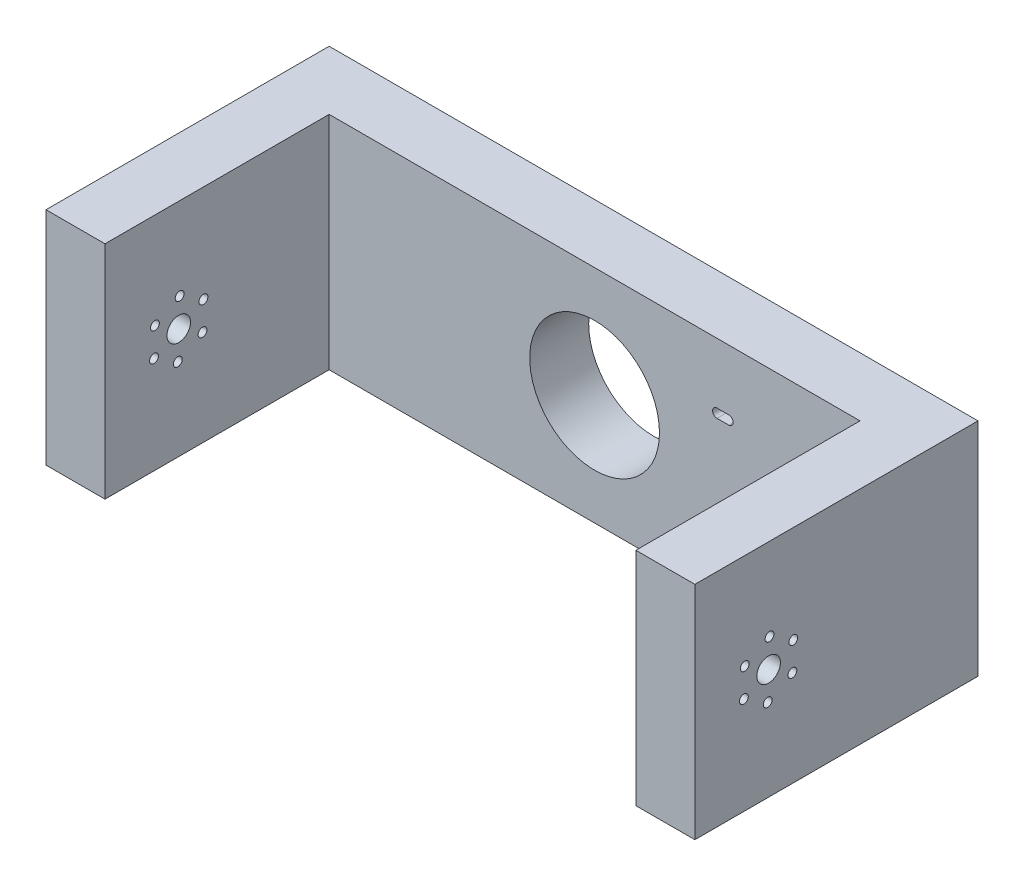
from build123d import *

# Parameters (mm, degrees)
ESQUISSE1_W             = 220
ESQUISSE1_H             = 75
BOSS_EXTRU_1_DEPTH      = 20
ESQUISSE2_W             = 20
ESQUISSE2_H             = 75
BOSS_EXTRU_2_DEPTH      = 76
ESQUISSE3_R             = 4
ENL_V_MAT_EXTRU_1_DEPTH = 252.4776332
ESQUISSE4_R             = 22
ENL_V_MAT_EXTRU_2_DEPTH = 76
ESQUISSE5_R             = 1.5
ENL_V_MAT_EXTRU_3_DEPTH = 252.4776332
ENL_V_MAT_EXTRU_5_DEPTH = 245.542429856


with BuildPart() as part:
    # Esquisse1 → Boss.-Extru.1 (new body)
    with BuildSketch(Plane.XY):
        with Locations((110, 37.5)):
            Rectangle(ESQUISSE1_W, ESQUISSE1_H)
    extrude(amount=BOSS_EXTRU_1_DEPTH)

    # Esquisse2 → Boss.-Extru.2 (add)
    with BuildSketch(Plane.XY.offset(20)):
        with Locations((210, 37.5)):
            Rectangle(ESQUISSE2_W, ESQUISSE2_H)
        with Locations((10, 37.5)):
            Rectangle(ESQUISSE2_W, ESQUISSE2_H)
    extrude(amount=BOSS_EXTRU_2_DEPTH)

    # Esquisse3 → Enlèv. mat.-Extru.1 (cut, through all)
    with BuildSketch(Plane(origin=(220, 0, 0), x_dir=(0, 0, -1), z_dir=(1, 0, 0))):
        with Locations((-71, 37.5)):
            Circle(ESQUISSE3_R)
    extrude(amount=-ENL_V_MAT_EXTRU_1_DEPTH, mode=Mode.SUBTRACT)

    # Esquisse4 → Enlèv. mat.-Extru.2 (cut)
    with BuildSketch(Plane.XY.offset(20)):
        with Locations((110, 37.5)):
            Circle(ESQUISSE4_R)
    extrude(amount=-ENL_V_MAT_EXTRU_2_DEPTH, mode=Mode.SUBTRACT)

    # Esquisse5 → Enlèv. mat.-Extru.3 (cut, through all)
    with BuildSketch(Plane(origin=(220, 0, 0), x_dir=(0, 0, -1), z_dir=(1, 0, 0))):
        with Locations((-70.685514893, 47)):
            Circle(ESQUISSE5_R)
        with Locations((-62.61551611, 41.977647908)):
            Circle(ESQUISSE5_R)
        with Locations((-62.930001218, 32.477647908)):
            Circle(ESQUISSE5_R)
        with Locations((-71.314485107, 28)):
            Circle(ESQUISSE5_R)
        with Locations((-79.38448389, 33.022352092)):
            Circle(ESQUISSE5_R)
        with Locations((-79.069998782, 42.522352092)):
            Circle(ESQUISSE5_R)
    extrude(amount=-ENL_V_MAT_EXTRU_3_DEPTH, mode=Mode.SUBTRACT)

    # Esquisse6 → Enlèv. mat.-Extru.5 (cut, through all)
    with BuildSketch(Plane.XY.offset(20)):
        with BuildLine():
            Line((182.5, 54.5), (186.5, 54.5))
            ThreePointArc((186.5, 54.5), (188, 53), (186.5, 51.5))
            Line((186.5, 51.5), (182.5, 51.5))
            ThreePointArc((182.5, 51.5), (181, 53), (182.5, 54.5))
        make_face()
        with BuildLine():
            Line((151.5, 51.5), (155.5, 51.5))
            ThreePointArc((155.5, 51.5), (157, 53), (155.5, 54.5))
            Line((155.5, 54.5), (151.5, 54.5))
            ThreePointArc((151.5, 54.5), (150, 53), (151.5, 51.5))
        make_face()
        with BuildLine():
            Line((151.5, 20.5), (155.5, 20.5))
            ThreePointArc((155.5, 20.5), (157, 22), (155.5, 23.5))
            Line((155.5, 23.5), (151.5, 23.5))
            ThreePointArc((151.5, 23.5), (150, 22), (151.5, 20.5))
        make_face()
        with BuildLine():
            Line((182.5, 20.5), (186.5, 20.5))
            ThreePointArc((186.5, 20.5), (188, 22), (186.5, 23.5))
            Line((186.5, 23.5), (182.5, 23.5))
            ThreePointArc((182.5, 23.5), (181, 22), (182.5, 20.5))
        make_face()
    extrude(amount=-ENL_V_MAT_EXTRU_5_DEPTH, mode=Mode.SUBTRACT)


solid = part.part
